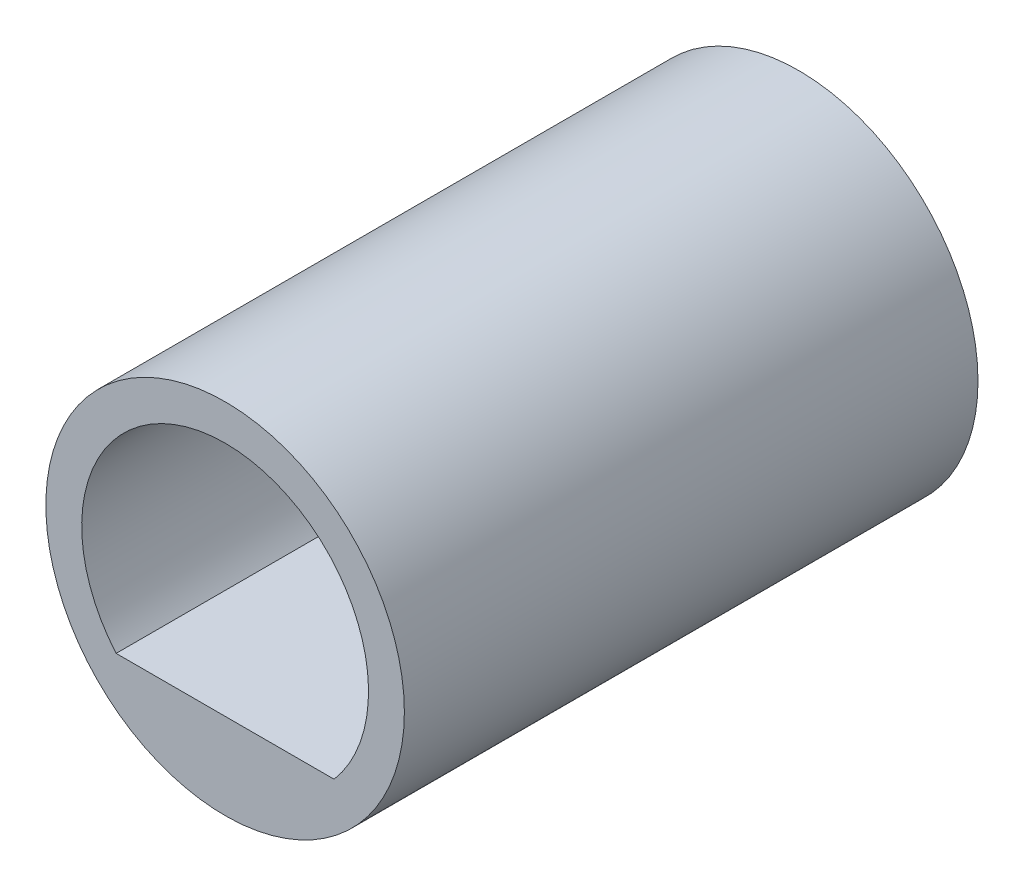
from build123d import *

# Parameters (mm, degrees)
IZIM1_R                     = 2.5
Y_KSEKLIK_EKSTR_ZYON1_DEPTH = 8


with BuildPart() as part:
    # Çizim1 → Yükseklik-Ekstrüzyon1 (new body)
    with BuildSketch(Plane.XY):
        Circle(IZIM1_R)
        with BuildLine():
            Line((-1.519868415, -1.3), (1.519868415, -1.3))
            ThreePointArc((1.519868415, -1.3), (0, 2), (-1.519868415, -1.3))
        make_face(mode=Mode.SUBTRACT)
    extrude(amount=Y_KSEKLIK_EKSTR_ZYON1_DEPTH)


solid = part.part
